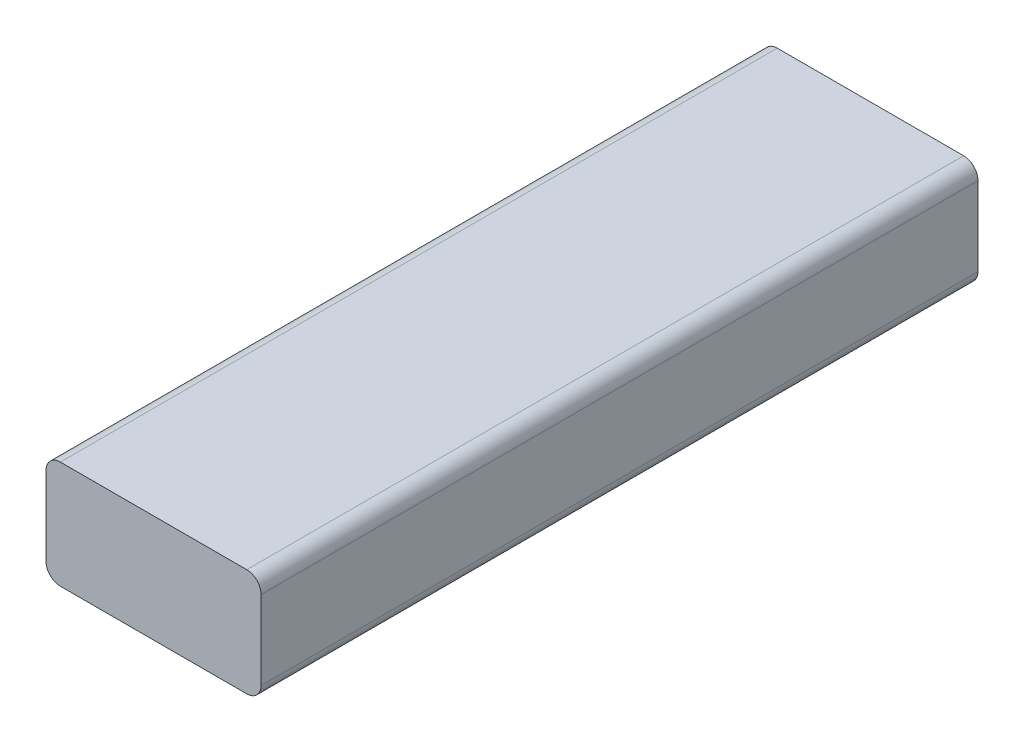
from build123d import *

# Parameters (mm, degrees)
SKETCH1_W           = 76.2
SKETCH1_H           = 38.1
BOSS_EXTRUDE1_DEPTH = 254
FILLET1_R           = 5.08


with BuildPart() as part:
    # Sketch1 → Boss-Extrude1 (new body)
    with BuildSketch(Plane.XY):
        with Locations((38.1, 19.05)):
            Rectangle(SKETCH1_W, SKETCH1_H)
    extrude(amount=BOSS_EXTRUDE1_DEPTH)

    # Fillet1
    fillet1_edges = [part.edges().sort_by_distance(p)[0] for p in [
        (0, 38.1, 127),
        (76.2, 38.1, 127),
        (76.2, 0, 127),
        (0, 0, 127),
    ]]
    fillet(fillet1_edges, radius=FILLET1_R)


solid = part.part
